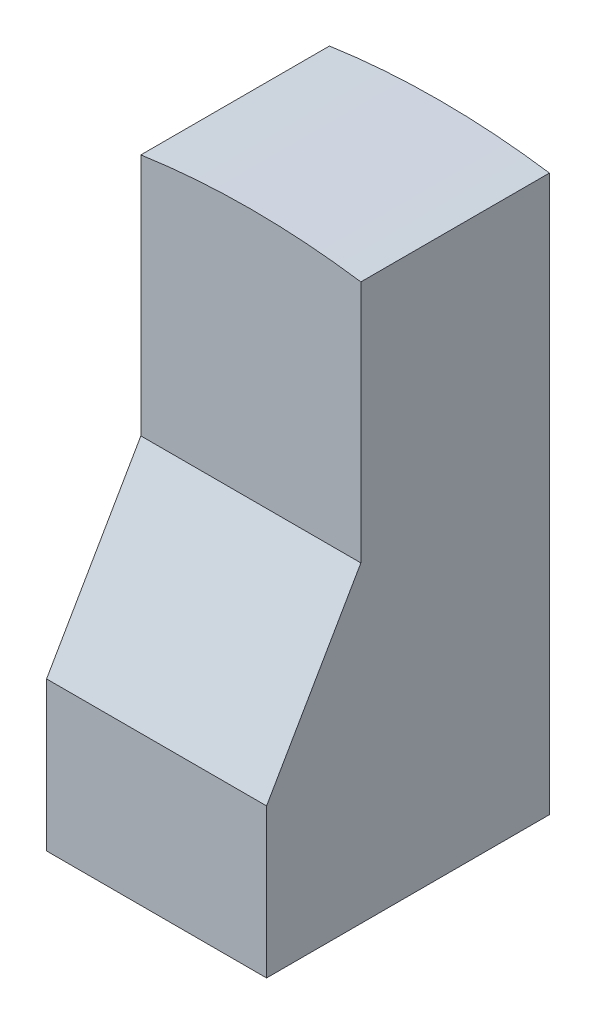
from build123d import *

# Parameters (mm, degrees)
BOSS_EXTRUDE1_DEPTH = 22.5
CUT_EXTRUDE1_DEPTH  = 128.008857959


with BuildPart() as part:
    # Sketch1 → Boss-Extrude1 (new, symmetric)
    with BuildSketch(Plane.XY):
        with BuildLine():
            Line((-17.5, 118.717100706), (-17.5, 30.31))
            Line((-17.5, 30.31), (17.5, 30.31))
            Line((17.5, 30.31), (17.5, 118.717100706))
            ThreePointArc((17.5, 118.717100706), (0, 120), (-17.5, 118.717100706))
        make_face()
    extrude(amount=BOSS_EXTRUDE1_DEPTH, both=True)

    # Sketch2 → Cut-Extrude1 (cut, through all)
    with BuildSketch(Plane(origin=(17.5, 0, 0), x_dir=(0, 0, -1), z_dir=(1, 0, 0))):
        Polygon((-22.5, 54.019237886), (-7.5, 80), (-7.5, 120), (-22.5, 120), align=None)
    extrude(amount=-CUT_EXTRUDE1_DEPTH, mode=Mode.SUBTRACT)


solid = part.part
